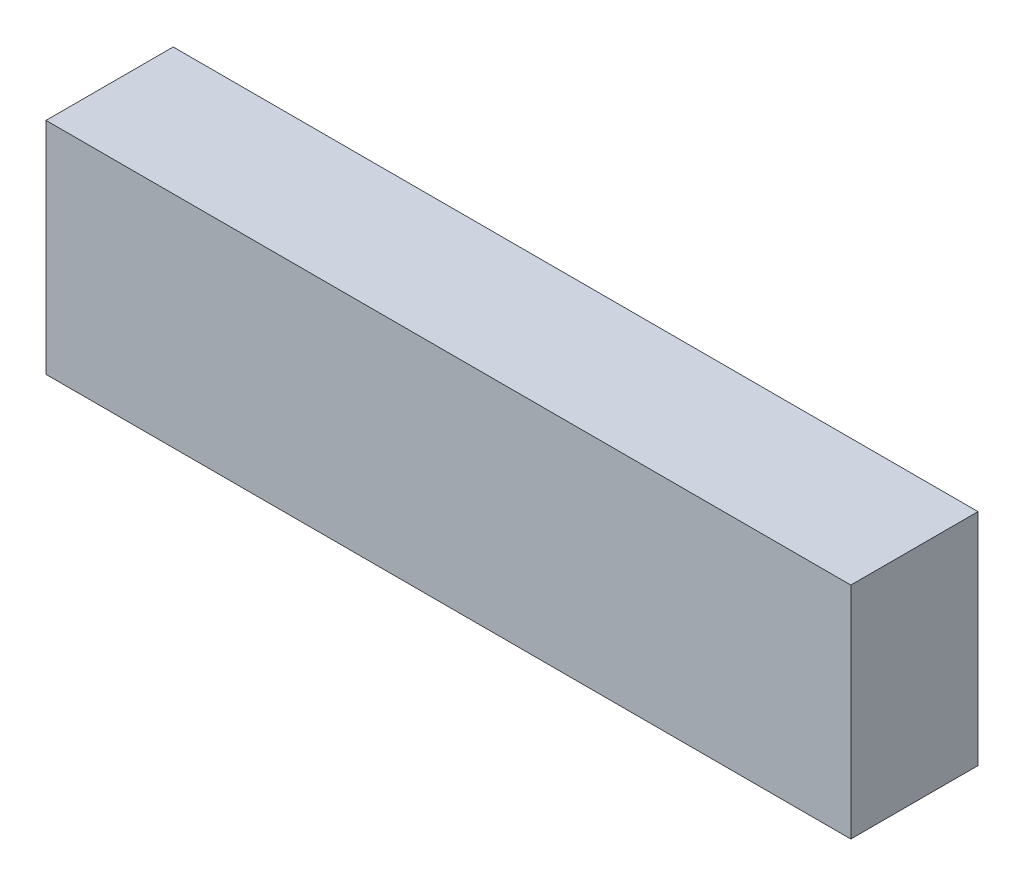
from build123d import *

# Parameters (mm, degrees)
SKETCH1_W                 = 45.88
SKETCH1_H                 = 12.54
BOSS_EXTRUDE1_DEPTH       = 7.25
SHELL1_T                  = -0.5
SHELL1_THICKNESS_2_FACE_W = 44.88
SHELL1_THICKNESS_2_FACE_H = 11.54
SHELL1_THICKNESS_2_DEPTH  = 0.3


with BuildPart() as part:
    # Sketch1 → Boss-Extrude1 (new body)
    with BuildSketch(Plane.XY):
        with Locations((30.8045, 23.92)):
            Rectangle(SKETCH1_W, SKETCH1_H)
    extrude(amount=BOSS_EXTRUDE1_DEPTH)

    # Shell1
    shell1_openings = [part.faces().sort_by_distance(p)[0] for p in [
        (30.8045, 23.92, 0),
    ]]
    offset(amount=SHELL1_T, openings=shell1_openings, kind=Kind.INTERSECTION)

    # Shell1 thickness 2 face (on inner face of the shell) → Shell1 thickness 2 (cut)
    with BuildSketch(Plane(origin=(30.8045, 23.92, 6.75), x_dir=(1, 0, 0), z_dir=(0, 0, 1))):
        Rectangle(SHELL1_THICKNESS_2_FACE_W, SHELL1_THICKNESS_2_FACE_H)
    extrude(amount=SHELL1_THICKNESS_2_DEPTH, mode=Mode.SUBTRACT)


solid = part.part
